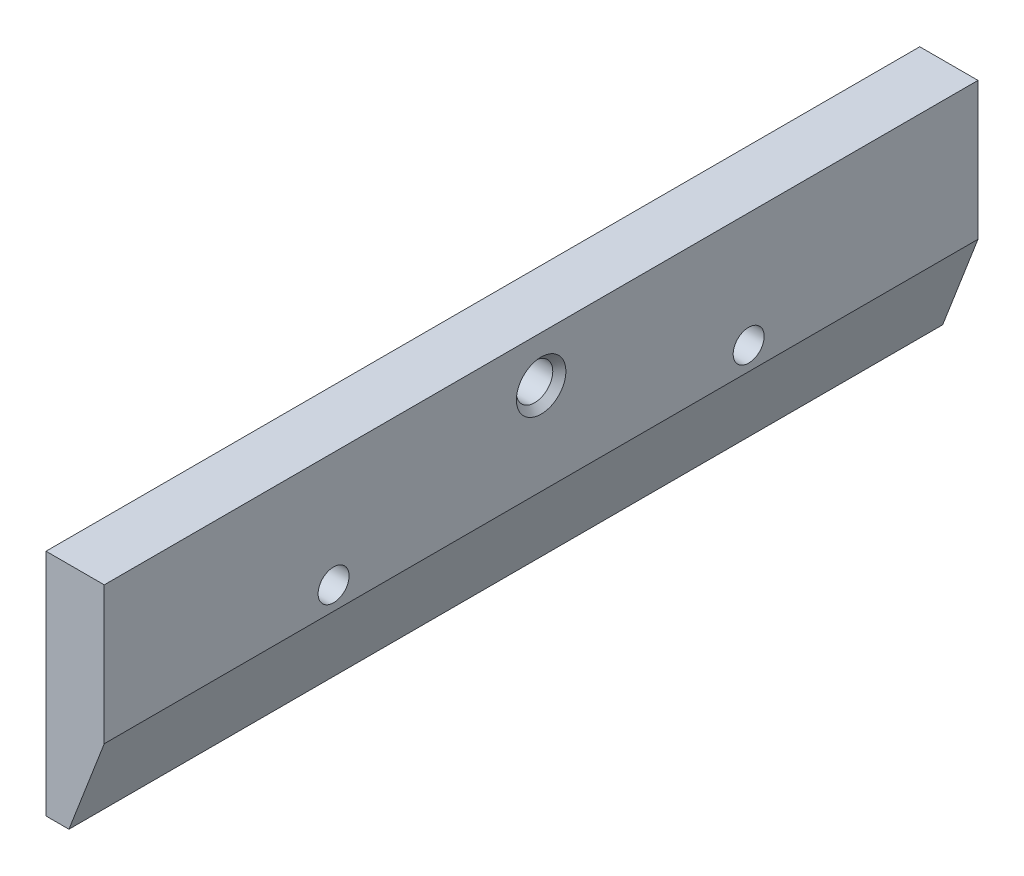
from build123d import *

# Parameters (mm, degrees)
SALIENTE_EXTRUIR1_DEPTH       = 95.25
TALADRO_DE_MARGEN_PARA_1_41_D = 6.7564


with BuildPart() as part:
    # Croquis1 → Saliente-Extruir1 (new, symmetric)
    with BuildSketch(Plane.XY):
        Polygon((-1.35, -25), (6.35, -5), (6.35, 25), (-6.35, 25), (-6.35, -25), align=None)
    extrude(amount=SALIENTE_EXTRUIR1_DEPTH, both=True)

    # Taladro de margen para 1/41 (through all)
    with Locations(Plane(origin=(6.35, 0, 0), x_dir=(0, 0, -1), z_dir=(1, 0, 0))):
        with Locations((-45.25, 0), (45.25, 0)):
            Hole(TALADRO_DE_MARGEN_PARA_1_41_D / 2)

    # Croquis7 → Taladro roscado 3/8-161 (revolve, cut)
    with BuildSketch(Plane(origin=(6.35, 15, 0), x_dir=(0, 0, -1), z_dir=(0, 1, 0))):
        Polygon((0, 0), (0, 12.7), (5.3975, 12.7), (3.96875, 11.27125), (3.96875, 1.42875), (5.3975, 0), align=None)
    revolve(axis=Axis((12.7, 15, 0), (-1, 0, 0)), mode=Mode.SUBTRACT)


solid = part.part
